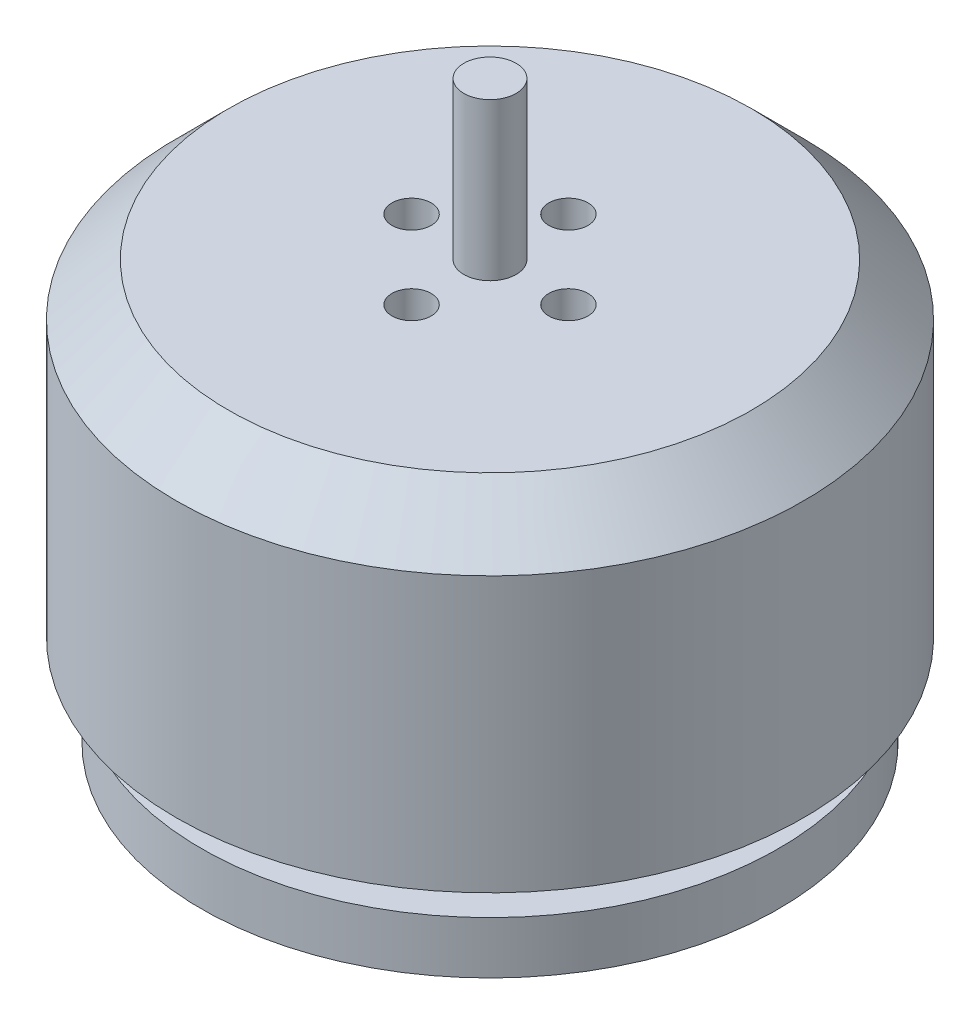
from build123d import *

# Parameters (mm, degrees)
SKETCH2_R          = 1.5
CUT_EXTRUDE1_DEPTH = 3.3
SKETCH3_R          = 1.5
CUT_EXTRUDE2_DEPTH = 8


with BuildPart() as part:
    # Sketch1 → Revolve1 (revolve)
    with BuildSketch(Plane.XY, mode=Mode.PRIVATE) as revolve1_sk:
        Polygon((0, 0), (22.08, 0), (22.08, 4), (16.8, 4), (16.8, 7), (24, 7), (24, 28), (20, 32), (2, 32), (2, 44), (0, 44), align=None)
    revolve(revolve1_sk.sketch.rotate(Axis((0, -10, 0), (0, 1, 0)), 90), axis=Axis((0, -10, 0), (0, 1, 0)))

    # Sketch2 → Cut-Extrude1 (cut)
    with BuildSketch(Plane(origin=(0, 0, 0), x_dir=(1, 0, 0), z_dir=(0, 1, 0))):
        with Locations(Location((8.84, -8.84, 0), (0, 0, 270))):
            Circle(SKETCH2_R)
        with Locations(Location((8.84, 8.84, 0), (0, 0, 270))):
            Circle(SKETCH2_R)
        with Locations(Location((-8.84, -8.84, 0), (0, 0, 270))):
            Circle(SKETCH2_R)
        with Locations(Location((-8.84, 8.84, 0), (0, 0, 270))):
            Circle(SKETCH2_R)
    extrude(amount=CUT_EXTRUDE1_DEPTH, mode=Mode.SUBTRACT)

    # Sketch3 → Cut-Extrude2 (cut)
    with BuildSketch(Plane(origin=(0, 32, 0), x_dir=(1, 0, 0), z_dir=(0, 1, 0))):
        with Locations(Location((6, 0, 0), (0, 0, 270))):
            Circle(SKETCH3_R)
        with Locations(Location((-6, 0, 0), (0, 0, 270))):
            Circle(SKETCH3_R)
        with Locations(Location((0, -6, 0), (0, 0, 270))):
            Circle(SKETCH3_R)
        with Locations(Location((0, 6, 0), (0, 0, 270))):
            Circle(SKETCH3_R)
    extrude(amount=-CUT_EXTRUDE2_DEPTH, mode=Mode.SUBTRACT)


solid = part.part
